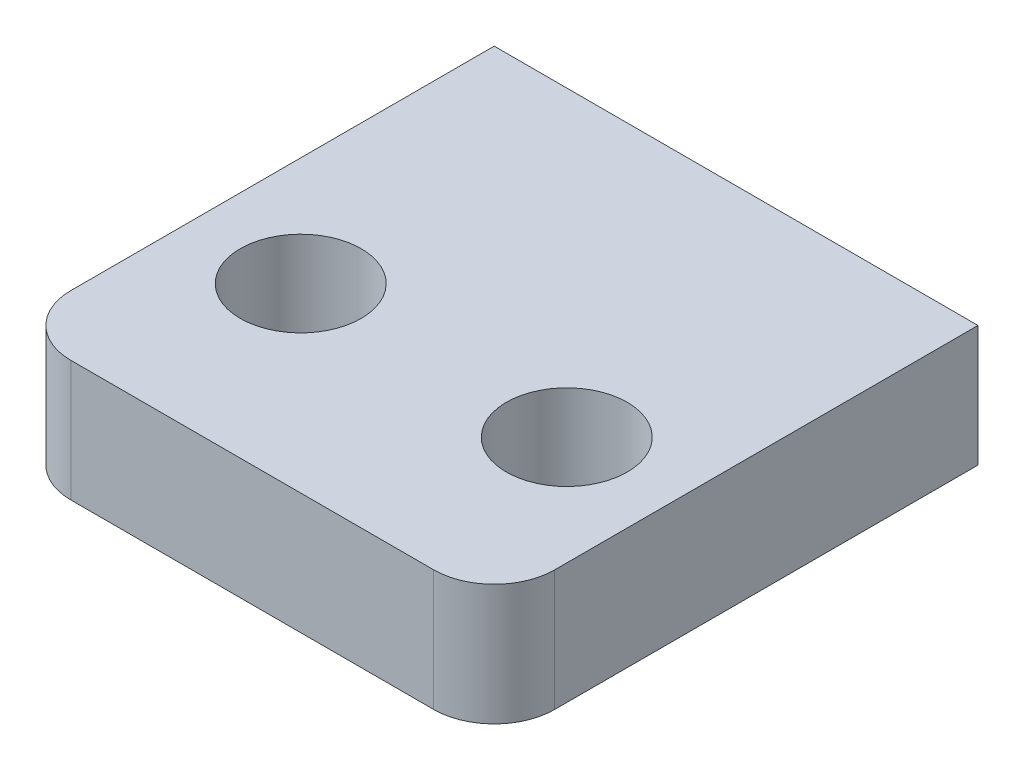
from build123d import *

# Parameters (mm, degrees)
CROQUIS2_W              = 80
CROQUIS2_H              = 80
SALIENTE_EXTRUIR1_DEPTH = 20
REDONDEO1_R             = 10
REDONDEO2_R             = 10
CROQUIS3_R              = 10
CORTAR_EXTRUIR1_DEPTH   = 79.988983231


with BuildPart() as part:
    # Croquis2 → Saliente-Extruir1 (new body)
    with BuildSketch(Plane(origin=(0, 0, 0), x_dir=(1, 0, 0), z_dir=(0, 1, 0))):
        with Locations((-24.623955432, -0.77994429)):
            Rectangle(CROQUIS2_W, CROQUIS2_H)
    extrude(amount=SALIENTE_EXTRUIR1_DEPTH)

    # Redondeo1
    redondeo1_edges = [part.edges().sort_by_distance(p)[0] for p in [
        (15.376044568, 10, 40.77994429),
    ]]
    fillet(redondeo1_edges, radius=REDONDEO1_R)

    # Redondeo2
    redondeo2_edges = [part.edges().sort_by_distance(p)[0] for p in [
        (-64.623955432, 10, 40.77994429),
    ]]
    fillet(redondeo2_edges, radius=REDONDEO2_R)

    # Croquis3 → Cortar-Extruir1 (cut, through all)
    with BuildSketch(Plane(origin=(0, 20, 0), x_dir=(1, 0, 0), z_dir=(0, 1, 0))):
        with Locations(Location((-46.623955432, -10.77994429, 0), (0, 0, 270))):
            Circle(CROQUIS3_R)
        with Locations(Location((-2.623955432, -10.77994429, 0), (0, 0, 90))):
            Circle(CROQUIS3_R)
    extrude(amount=-CORTAR_EXTRUIR1_DEPTH, mode=Mode.SUBTRACT)


solid = part.part
